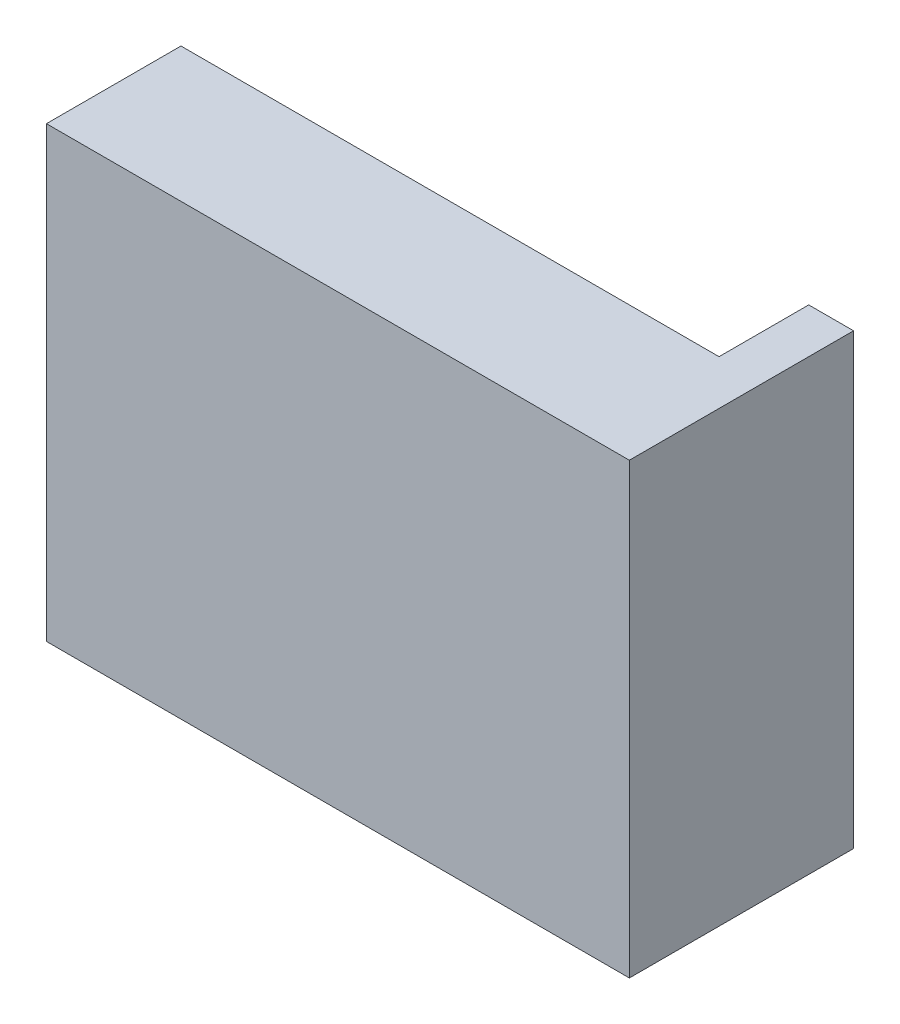
from build123d import *

# Parameters (mm, degrees)
ESBO_O1_W                = 26
ESBO_O1_H                = 20
RESSALTO_EXTRUS_O1_DEPTH = 6
ESBO_O2_W                = 2
ESBO_O2_H                = 20
RESSALTO_EXTRUS_O2_DEPTH = 4
CORTE_EXTRUS_O1_DEPTH    = 2


with BuildPart() as part:
    # Esboço1 → Ressalto-extrusão1 (new body)
    with BuildSketch(Plane.XY):
        with Locations((-13, 10)):
            Rectangle(ESBO_O1_W, ESBO_O1_H)
    extrude(amount=RESSALTO_EXTRUS_O1_DEPTH)

    # Esboço2 → Ressalto-extrusão2 (add)
    with BuildSketch(Plane(origin=(0, 0, 0), x_dir=(-1, 0, 0), z_dir=(0, 0, -1))):
        with Locations((1, 10)):
            Rectangle(ESBO_O2_W, ESBO_O2_H)
    extrude(amount=RESSALTO_EXTRUS_O2_DEPTH)

    # Esboço3 → Corte-extrusão1 (cut)
    with BuildSketch(Plane(origin=(0, 0, 0), x_dir=(-1, 0, 0), z_dir=(0, 0, -1))):
        with BuildLine():
            Line((5, 10), (26, 10))
            Line((26, 10), (26, 14))
            Line((26, 14), (5, 14))
            ThreePointArc((5, 14), (3, 12), (5, 10))
        make_face()
    extrude(amount=-CORTE_EXTRUS_O1_DEPTH, mode=Mode.SUBTRACT)


solid = part.part
